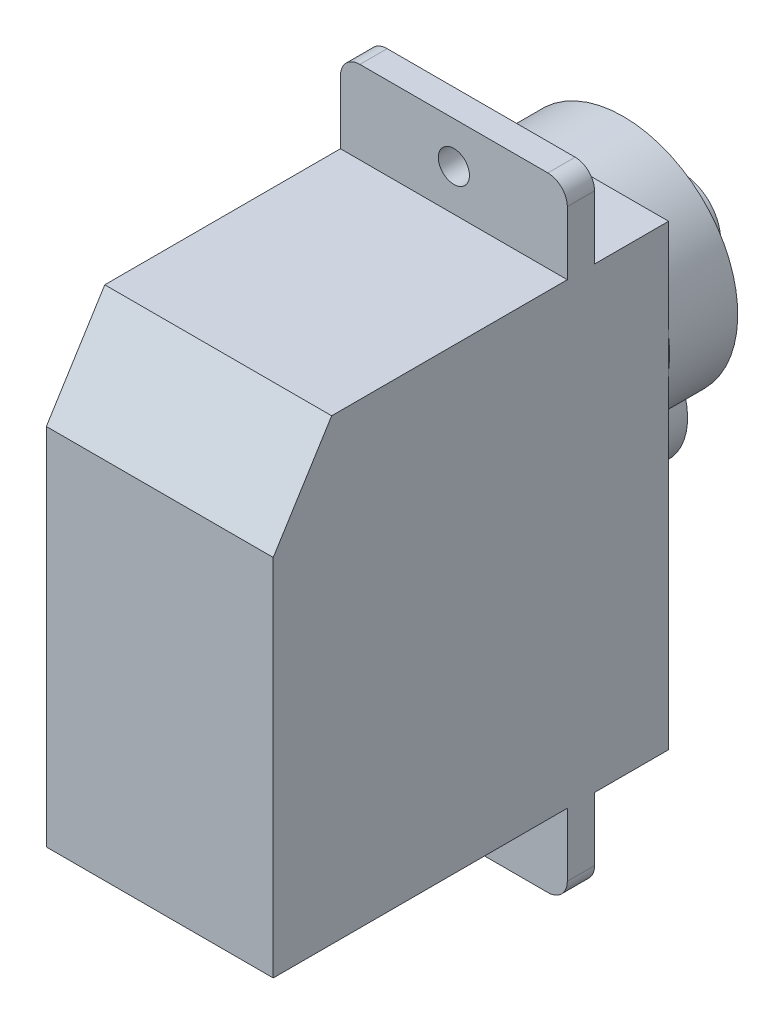
from build123d import *

# Parameters (mm, degrees)
SKETCH_1_W                  = 32
SKETCH_1_H                  = 20.3
EXTRUDE_1_DEPTH             = 11.65
EXTRUDE_2_DEPTH             = 3.5
SKETCH_3_W                  = 3.8
SKETCH_3_H                  = 4.25
CUT_EXTRUDE_1_DEPTH         = 29.372169462
SKETCH_4_W                  = 3.8
SKETCH_4_H                  = 4.25
CUT_EXTRUDE_2_DEPTH         = 29.372169462
SKETCH_5_W                  = 15.1
SKETCH_5_H                  = 4.25
CUT_EXTRUDE_3_DEPTH         = 29.372169462
SKETCH_6_W                  = 15.1
SKETCH_6_H                  = 4.25
CUT_EXTRUDE_4_DEPTH         = 29.372169462
SKETCH_7_W                  = 2
SKETCH_7_H                  = 3
SKETCH_8_W                  = 1
SKETCH_8_H                  = 1
HOLE_WIZARD_1_6_1_6_1_D     = 1.6
HOLE_WIZARD_1_6_1_6_1_DEPTH = 11.7
CHAMFER_1_SIZE              = 3
CHAMFER_1_SIZE2             = 4.8
FILLET_1_R                  = 1


with BuildPart() as part:
    # Эскиз1 → Бобышка-Вытянуть1 (new body)
    with BuildSketch(Plane(origin=(-5.825, 0, 0), x_dir=(0, -1, 0), z_dir=(-1, 0, 0))):
        with Locations((0, 10.15)):
            Rectangle(SKETCH_1_W, SKETCH_1_H)
    extrude(amount=-EXTRUDE_1_DEPTH)

    # Эскиз2 → Бобышка-Вытянуть2 (add)
    with BuildSketch(Plane(origin=(0, 0, 0), x_dir=(-1, 0, 0), z_dir=(0, 0, -1))):
        with BuildLine():
            ThreePointArc((-3.1671795, 0.926808511), (0, 11.75), (3.1671795, 0.926808511))
            ThreePointArc((3.1671795, 0.926808511), (0, -3.3), (-3.1671795, 0.926808511))
        make_face()
    extrude(amount=EXTRUDE_2_DEPTH)

    # Эскиз3 → Вырез-Вытянуть1 (cut, through all)
    with BuildSketch(Plane.ZY.offset(5.825)):
        with Locations((1.9, 13.875)):
            Rectangle(SKETCH_3_W, SKETCH_3_H)
    extrude(amount=-CUT_EXTRUDE_1_DEPTH, mode=Mode.SUBTRACT)

    # Эскиз4 → Вырез-Вытянуть2 (cut, through all)
    with BuildSketch(Plane(origin=(5.825, 0, 0), x_dir=(0, 0, -1), z_dir=(1, 0, 0))):
        with Locations((-1.9, -13.875)):
            Rectangle(SKETCH_4_W, SKETCH_4_H)
    extrude(amount=-CUT_EXTRUDE_2_DEPTH, mode=Mode.SUBTRACT)

    # Эскиз5 → Вырез-Вытянуть3 (cut, through all)
    with BuildSketch(Plane(origin=(5.825, 0, 0), x_dir=(0, 0, -1), z_dir=(1, 0, 0))):
        with Locations((-12.75, -13.875)):
            Rectangle(SKETCH_5_W, SKETCH_5_H)
    extrude(amount=-CUT_EXTRUDE_3_DEPTH, mode=Mode.SUBTRACT)

    # Эскиз6 → Вырез-Вытянуть4 (cut, through all)
    with BuildSketch(Plane(origin=(5.825, 0, 0), x_dir=(0, 0, -1), z_dir=(1, 0, 0))):
        with Locations((-12.75, 13.875)):
            Rectangle(SKETCH_6_W, SKETCH_6_H)
    extrude(amount=-CUT_EXTRUDE_4_DEPTH, mode=Mode.SUBTRACT)

    # Эскиз7 → Повернуть1 (revolve)
    with BuildSketch(Plane.XZ.offset(-5.75), mode=Mode.PRIVATE) as revolve_1_sk:
        with Locations((1, -5)):
            Rectangle(SKETCH_7_W, SKETCH_7_H)
    revolve(revolve_1_sk.sketch.rotate(Axis((0, 5.75, -3.5), (0, 0, -1)), 180), axis=Axis((0, 5.75, -3.5), (0, 0, -1)))

    # Эскиз8 → Повернуть2 (revolve)
    with BuildSketch(Plane.XZ, mode=Mode.PRIVATE) as revolve_2_sk:
        with Locations((0.5, -4)):
            Rectangle(SKETCH_8_W, SKETCH_8_H)
    revolve(revolve_2_sk.sketch.rotate(Axis((0, 0, -3.5), (0, 0, -1)), 180), axis=Axis((0, 0, -3.5), (0, 0, -1)))

    # Диаметр отверстия Ø1.6 (1.6)1
    with Locations(Plane.XY.offset(5.2)):
        with Locations((0, -13.875), (0, 13.875)):
            Hole(HOLE_WIZARD_1_6_1_6_1_D / 2, depth=HOLE_WIZARD_1_6_1_6_1_DEPTH)

    # Фаска1
    chamfer_1_edges = [part.edges().sort_by_distance(p)[0] for p in [
        (0, 11.75, 20.3),
    ]]
    chamfer_1_side = [part.faces().sort_by_distance(p)[0] for p in [
        (0, 11.75, 12.75),
    ]]
    chamfer(chamfer_1_edges, length=CHAMFER_1_SIZE, length2=CHAMFER_1_SIZE2, reference=chamfer_1_side[0])

    # Скругление1
    fillet_1_edges = [part.edges().sort_by_distance(p)[0] for p in [
        (-5.825, -16, 4.5),
        (5.825, -16, 4.5),
        (-5.825, 16, 4.5),
        (5.825, 16, 4.5),
    ]]
    fillet(fillet_1_edges, radius=FILLET_1_R)


solid = part.part
